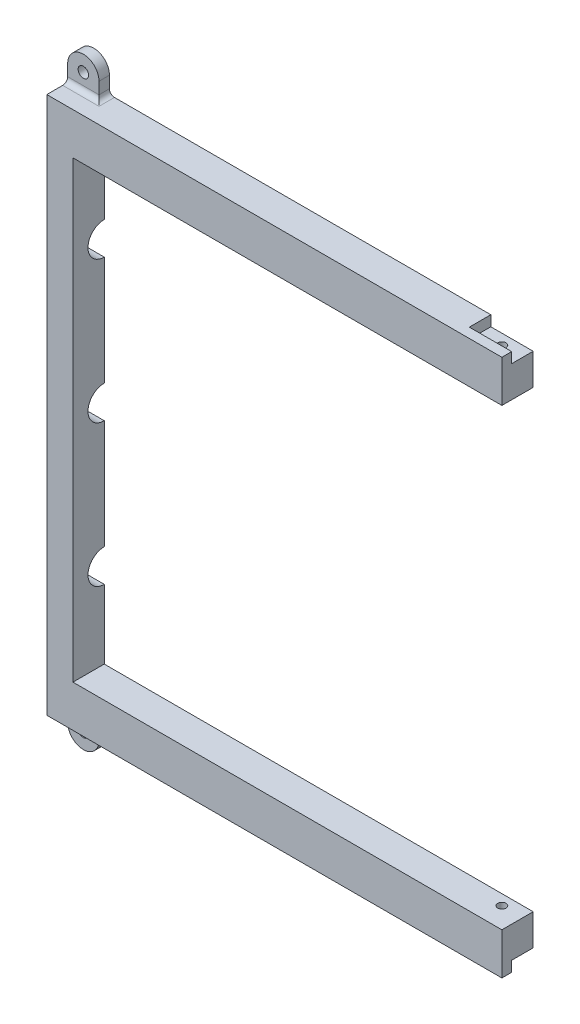
from build123d import *

# Parameters (mm, degrees)
SKETCH1_W               = 276.86
SKETCH1_H               = 163.5252
SKETCH1_W_2             = 260.9596
SKETCH1_H_2             = 138.1252
BOSS_EXTRUDE1_DEPTH     = 9.525
SKETCH2_R               = 4.953
CUT_EXTRUDE1_DEPTH      = 289.837857601
SKETCH3_R               = 1.5875
BOSS_EXTRUDE2_DEPTH     = 3.175
MIRROR2_COPY_1_SKETCH_R = 1.5875
MIRROR2_COPY_1_DEPTH    = 3.175
FILLET1_R               = 1.524
SKETCH4_W               = 25.781
SKETCH4_H               = 13.081
CUT_EXTRUDE2_DEPTH      = 3.175
CUT_EXTRUDE3_REACH      = 221.589
SKETCH5_R               = 1.27
CUT_EXTRUDE4_DEPTH      = 167.268111407


with BuildPart() as part:
    # Sketch1 → Boss-Extrude1 (new body)
    with BuildSketch(Plane.XY):
        Rectangle(SKETCH1_W, SKETCH1_H)
        Rectangle(SKETCH1_W_2, SKETCH1_H_2, mode=Mode.SUBTRACT)
    extrude(amount=BOSS_EXTRUDE1_DEPTH)

    # Sketch2 → Cut-Extrude1 (cut, through all)
    with BuildSketch(Plane(origin=(138.43, 0, 0), x_dir=(0, 0, -1), z_dir=(1, 0, 0))):
        Circle(SKETCH2_R)
        with Locations((0, 43.1038)):
            Circle(SKETCH2_R)
        with Locations((0, -43.1038)):
            Circle(SKETCH2_R)
    extrude(amount=-CUT_EXTRUDE1_DEPTH, mode=Mode.SUBTRACT)

    # Sketch3 → Boss-Extrude2 (add)
    with BuildSketch(Plane(origin=(0, 0, 0), x_dir=(-1, 0, 0), z_dir=(0, 0, -1))):
        with BuildLine():
            Line((-138.43, 81.7626), (-138.43, 86.8426))
            ThreePointArc((-138.43, 86.8426), (-133.6675, 91.6051), (-128.905, 86.8426))
            Line((-128.905, 86.8426), (-128.905, 81.7626))
            Line((-128.905, 81.7626), (-138.43, 81.7626))
        make_face()
        with Locations((-133.6675, 86.8426)):
            Circle(SKETCH3_R, mode=Mode.SUBTRACT)
    boss_extrude2 = extrude(amount=-BOSS_EXTRUDE2_DEPTH)

    # Mirror1: Boss-Extrude2 across plane
    add(boss_extrude2.mirror(Plane(origin=(0, 0, 0), x_dir=(0, 0, 1), z_dir=(1, 0, 0))))

    # Mirror2: Boss-Extrude2 across plane
    add(boss_extrude2.mirror(Plane.ZX))

    # Mirror2 copy 1 sketch → Mirror2 copy 1 (add)
    with BuildSketch(Plane(origin=(0, 0, 0), x_dir=(1, 0, 0), z_dir=(0, 0, -1))):
        with BuildLine():
            Line((-138.43, 81.7626), (-138.43, 86.8426))
            ThreePointArc((-138.43, 86.8426), (-133.6675, 91.6051), (-128.905, 86.8426))
            Line((-128.905, 86.8426), (-128.905, 81.7626))
            Line((-128.905, 81.7626), (-138.43, 81.7626))
        make_face()
        with Locations((-133.6675, 86.8426)):
            Circle(MIRROR2_COPY_1_SKETCH_R, mode=Mode.SUBTRACT)
    extrude(amount=-MIRROR2_COPY_1_DEPTH)

    # Fillet1
    fillet1_edges = [part.edges().sort_by_distance(p)[0] for p in [
        (133.6675, -81.7626, 3.175),
        (128.905, -81.7626, 1.5875),
        (-133.6675, -81.7626, 3.175),
        (-128.905, -81.7626, 1.5875),
        (133.6675, 81.7626, 3.175),
        (128.905, 81.7626, 1.5875),
        (-133.6675, 81.7626, 3.175),
        (-128.905, 81.7626, 1.5875),
    ]]
    fillet(fillet1_edges, radius=FILLET1_R)

    # Sketch4 → Cut-Extrude2 (cut)
    with BuildSketch(Plane(origin=(0, 81.7626, 0), x_dir=(1, 0, 0), z_dir=(0, 1, 0))):
        Rectangle(SKETCH4_W, SKETCH4_H)
    cut_extrude2 = extrude(amount=-CUT_EXTRUDE2_DEPTH, mode=Mode.SUBTRACT)

    # Sketch5 → Cut-Extrude3 (cut, up to next)
    with BuildSketch(Plane(origin=(0, 78.5876, 0), x_dir=(1, 0, 0), z_dir=(0, 1, 0)), mode=Mode.PRIVATE) as cut_extrude3_sk1:
        with Locations(Location((6.35, -3.175, 0), (0, 0, 270))):
            Circle(SKETCH5_R)
    cut_extrude3_tool1 = extrude(cut_extrude3_sk1.sketch, amount=-CUT_EXTRUDE3_REACH, mode=Mode.PRIVATE) & part.part
    # Sketch5 → Cut-Extrude3 (cut, up to next)
    with BuildSketch(Plane(origin=(0, 78.5876, 0), x_dir=(1, 0, 0), z_dir=(0, 1, 0)), mode=Mode.PRIVATE) as cut_extrude3_sk2:
        with Locations(Location((-6.35, -3.175, 0), (0, 0, 270))):
            Circle(SKETCH5_R)
    cut_extrude3_tool2 = extrude(cut_extrude3_sk2.sketch, amount=-CUT_EXTRUDE3_REACH, mode=Mode.PRIVATE) & part.part
    cut_extrude3_1 = cut_extrude3_tool1.solids().sort_by_distance((6.35, 78.5876, 3.175))[0]
    add(cut_extrude3_1, mode=Mode.SUBTRACT)
    cut_extrude3_2 = cut_extrude3_tool2.solids().sort_by_distance((-6.35, 78.5876, 3.175))[0]
    add(cut_extrude3_2, mode=Mode.SUBTRACT)
    cut_extrude3 = cut_extrude3_1 + cut_extrude3_2  # Cut-Extrude3 as one shape, for the pattern or mirror that repeats it

    # Mirror3: Cut-Extrude2, Cut-Extrude3 across plane
    add(cut_extrude2.mirror(Plane.ZX), mode=Mode.SUBTRACT)
    add(cut_extrude3.mirror(Plane.ZX), mode=Mode.SUBTRACT)

    # Sketch6 → Cut-Extrude4 (cut, through all)
    with BuildSketch(Plane.XY.offset(9.525)):
        Polygon((0, 0), (0, -104.98366469), (173.485151705, -104.98366469), (173.485151705, 103.000167652), (0, 103.000167652), align=None)
    extrude(amount=-CUT_EXTRUDE4_DEPTH, mode=Mode.SUBTRACT)


solid = part.part
